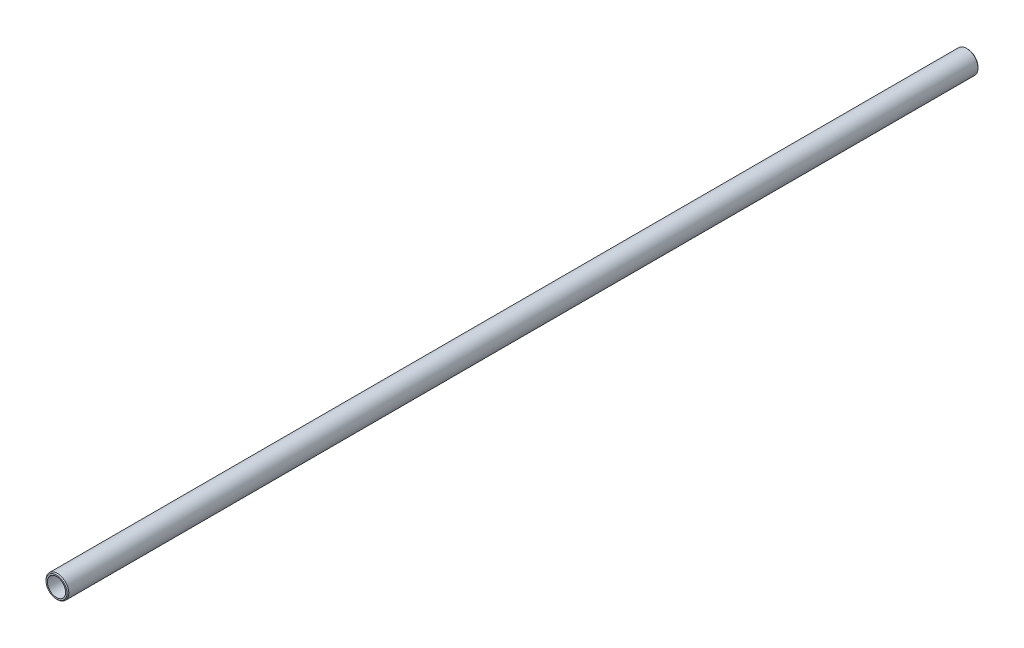
from build123d import *

# Parameters (mm, degrees)
SKETCH1_R         = 5
SKETCH1_R_2       = 4
BODY_DEPTH        = 400
END_CHAMFERS_SIZE = 0.4


with BuildPart() as part:
    # Sketch1 → body (new body)
    with BuildSketch(Plane.XY):
        Circle(SKETCH1_R)
        Circle(SKETCH1_R_2, mode=Mode.SUBTRACT)
    extrude(amount=BODY_DEPTH)

    # end_chamfers
    end_chamfers_edges = [part.edges().sort_by_distance(p)[0] for p in [
        (-5, 0, 0),
        (-5, 0, 400),
    ]]
    chamfer(end_chamfers_edges, length=END_CHAMFERS_SIZE)


solid = part.part
